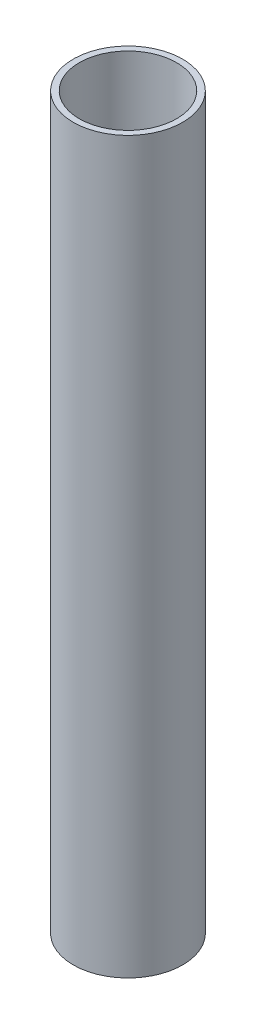
from build123d import *

# Parameters (mm, degrees)
SKETCH1_R           = 45
SKETCH1_R_2         = 40
BOSS_EXTRUDE1_DEPTH = 600


with BuildPart() as part:
    # Sketch1 → Boss-Extrude1 (new body)
    with BuildSketch(Plane(origin=(0, 0, 0), x_dir=(1, 0, 0), z_dir=(0, 1, 0))):
        with Locations(Location((0, 0, 0), (0, 0, 270))):
            Circle(SKETCH1_R)
        with Locations(Location((0, 0, 0), (0, 0, 270))):
            Circle(SKETCH1_R_2, mode=Mode.SUBTRACT)
    extrude(amount=BOSS_EXTRUDE1_DEPTH)


solid = part.part
